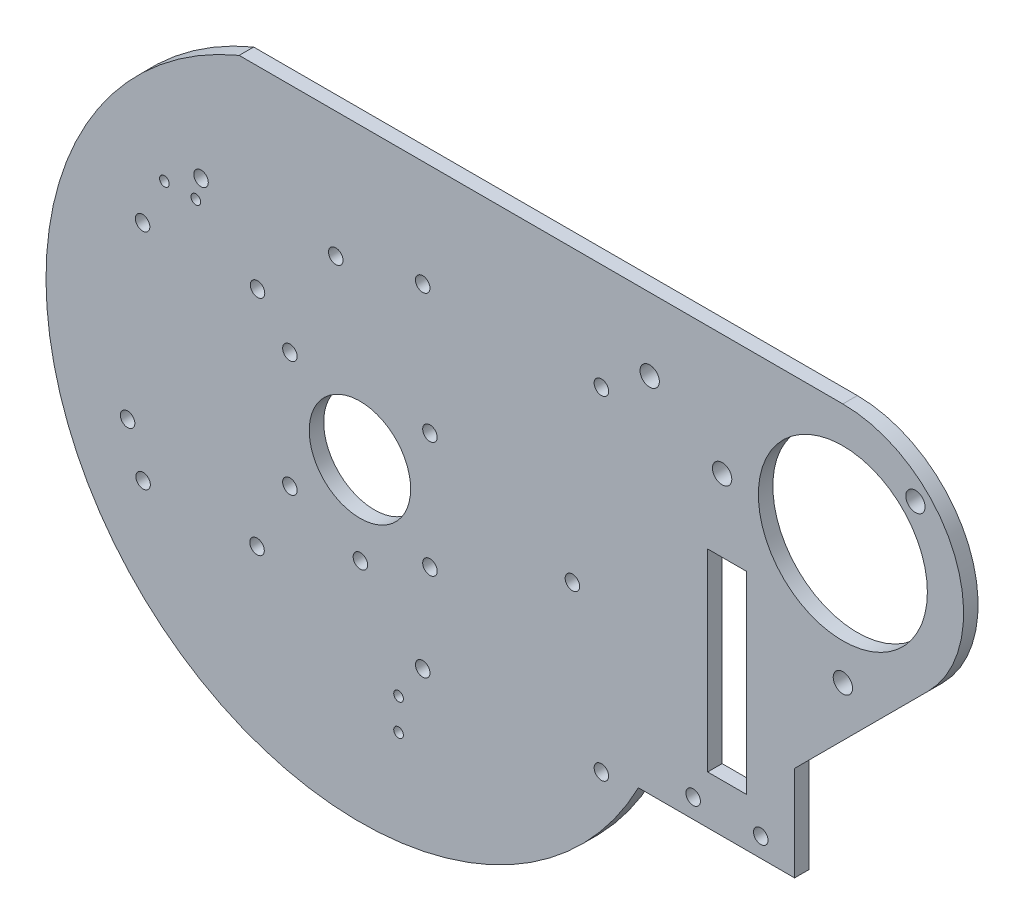
from build123d import *

# Parameters (mm, degrees)
SKETCH1_R                 = 10.5
SKETCH1_R_2               = 1.5
SKETCH1_W                 = 8
SKETCH1_H                 = 40
SKETCH1_R_3               = 17.5
BOSS_EXTRUDE1_DEPTH       = 3
CUT_EXTRUDE1_REACH        = 140.687
SKETCH2_R                 = 2
CUT_EXTRUDE2_REACH        = 140.687
SKETCH3_R                 = 2
BOSS_EXTRUDE2_START       = -3
SKETCH4_R                 = 65
SKETCH4_R_2               = 60
BOSS_EXTRUDE2_DEPTH       = 3
CUT_EXTRUDE3_START        = -10
CUT_EXTRUDE3_DEPTH        = 10
CUT_EXTRUDE4_START        = -10
CUT_EXTRUDE4_DEPTH        = 10
CUT_EXTRUDE5_REACH        = 142.922
SKETCH7_R                 = 1.5
CUT_EXTRUDE6_REACH        = 142.922
SKETCH8_R                 = 1.5
CUT_EXTRUDE7_REACH        = 142.922
SKETCH9_R                 = 1.5
F_3_0MM_DOWEL_HOLE1_D     = 3
F_3_0MM_DOWEL_HOLE1_DEPTH = 11.3
F_3_0MM_DOWEL_HOLE1_TIP   = 0.901290929
CUT_EXTRUDE8_REACH        = 142.922
SKETCH13_R                = 1


with BuildPart() as part:
    # Sketch1 → Boss-Extrude1 (new body)
    # profile 1 of 2: a face of its own
    with BuildSketch(Plane.XY):
        with BuildLine():
            ThreePointArc((-60, 0), (-52.867640737, 28.372743309), (-33.166247904, 50))
            Line((-33.166247904, 50), (-60, 50))
            Line((-60, 50), (-60, 0))
        make_face()
    # profile 2 of 2: a face of its own
    with BuildSketch(Plane.XY):
        with BuildLine():
            ThreePointArc((0, 60), (-17.320508076, 57.445626465), (-33.166247904, 50))
            ThreePointArc((-33.166247904, 50), (-52.867640737, 28.372743309), (-60, 0))
            ThreePointArc((-60, 0), (-15.529142706, -57.955549577), (51.961524227, -30))
            Line((51.961524227, -30), (56.568542495, -30))
            Line((56.568542495, -30), (90, -30))
            Line((90, -30), (90, -10.355339059))
            Line((90, -10.355339059), (117.67766953, 17.32233047))
            ThreePointArc((117.67766953, 17.32233047), (123.096988313, 44.567085809), (100, 60))
            Line((100, 60), (0, 60))
        make_face()
        Circle(SKETCH1_R, mode=Mode.SUBTRACT)
        with Locations((69, -26)):
            Circle(SKETCH1_R_2, mode=Mode.SUBTRACT)
        with Locations((76, 0)):
            Rectangle(SKETCH1_W, SKETCH1_H, mode=Mode.SUBTRACT)
        with Locations((83, -26)):
            Circle(SKETCH1_R_2, mode=Mode.SUBTRACT)
        with Locations((100, 35)):
            Circle(SKETCH1_R_3, mode=Mode.SUBTRACT)
    extrude(amount=BOSS_EXTRUDE1_DEPTH)

    # Sketch2 → Cut-Extrude1 (cut, up to next)
    with BuildSketch(Plane.XY.offset(3), mode=Mode.PRIVATE) as cut_extrude1_sk1:
        with Locations((60, 45)):
            Circle(SKETCH2_R)
    cut_extrude1_tool1 = extrude(cut_extrude1_sk1.sketch, amount=-CUT_EXTRUDE1_REACH, mode=Mode.PRIVATE) & part.part
    add(cut_extrude1_tool1.solids().sort_by_distance((60, 45, 3))[0], mode=Mode.SUBTRACT)

    # Sketch3 → Cut-Extrude2 (cut, up to next)
    with BuildSketch(Plane.XY.offset(3), mode=Mode.PRIVATE) as cut_extrude2_sk1:
        with Locations((100, 10)):
            Circle(SKETCH3_R)
    cut_extrude2_tool1 = extrude(cut_extrude2_sk1.sketch, amount=-CUT_EXTRUDE2_REACH, mode=Mode.PRIVATE) & part.part
    # Sketch3 → Cut-Extrude2 (cut, up to next)
    with BuildSketch(Plane.XY.offset(3), mode=Mode.PRIVATE) as cut_extrude2_sk2:
        with Locations((75, 35)):
            Circle(SKETCH3_R)
    cut_extrude2_tool2 = extrude(cut_extrude2_sk2.sketch, amount=-CUT_EXTRUDE2_REACH, mode=Mode.PRIVATE) & part.part
    # Sketch3 → Cut-Extrude2 (cut, up to next)
    with BuildSketch(Plane.XY.offset(3), mode=Mode.PRIVATE) as cut_extrude2_sk3:
        with Locations((115.0260191, 50.0260191)):
            Circle(SKETCH3_R)
    cut_extrude2_tool3 = extrude(cut_extrude2_sk3.sketch, amount=-CUT_EXTRUDE2_REACH, mode=Mode.PRIVATE) & part.part
    add(cut_extrude2_tool1.solids().sort_by_distance((100, 10, 3))[0], mode=Mode.SUBTRACT)
    add(cut_extrude2_tool2.solids().sort_by_distance((75, 35, 3))[0], mode=Mode.SUBTRACT)
    add(cut_extrude2_tool3.solids().sort_by_distance((115.026019, 50.026019, 3))[0], mode=Mode.SUBTRACT)

    # Sketch4 → Boss-Extrude2 (add)
    with BuildSketch(Plane.XY.offset(3).offset(BOSS_EXTRUDE2_START)):
        Circle(SKETCH4_R)
        Circle(SKETCH4_R_2, mode=Mode.SUBTRACT)
    extrude(amount=BOSS_EXTRUDE2_DEPTH)

    # Sketch5 → Cut-Extrude3 (cut)
    with BuildSketch(Plane.XY.offset(3).offset(CUT_EXTRUDE3_START)):
        with BuildLine():
            Line((-60, 50), (-41.533119315, 50))
            ThreePointArc((-41.533119315, 50), (-52.282822987, 38.62002616), (-60, 25))
            Line((-60, 25), (-60, 50))
        make_face()
    extrude(amount=CUT_EXTRUDE3_DEPTH, mode=Mode.SUBTRACT)

    # Sketch6 → Cut-Extrude4 (cut)
    with BuildSketch(Plane.XY.offset(3).offset(CUT_EXTRUDE4_START)):
        with BuildLine():
            Line((25, 60), (-25, 60))
            ThreePointArc((-25, 60), (0, 65), (25, 60))
        make_face()
    extrude(amount=CUT_EXTRUDE4_DEPTH, mode=Mode.SUBTRACT)

    # Sketch7 → Cut-Extrude5 (cut, up to next)
    with BuildSketch(Plane.XY.offset(3), mode=Mode.PRIVATE) as cut_extrude5_sk1:
        with Locations((-14.5, 12)):
            Circle(SKETCH7_R)
    cut_extrude5_tool1 = extrude(cut_extrude5_sk1.sketch, amount=-CUT_EXTRUDE5_REACH, mode=Mode.PRIVATE) & part.part
    # Sketch7 → Cut-Extrude5 (cut, up to next)
    with BuildSketch(Plane.XY.offset(3), mode=Mode.PRIVATE) as cut_extrude5_sk2:
        with Locations((14.5, 12)):
            Circle(SKETCH7_R)
    cut_extrude5_tool2 = extrude(cut_extrude5_sk2.sketch, amount=-CUT_EXTRUDE5_REACH, mode=Mode.PRIVATE) & part.part
    # Sketch7 → Cut-Extrude5 (cut, up to next)
    with BuildSketch(Plane.XY.offset(3), mode=Mode.PRIVATE) as cut_extrude5_sk3:
        with Locations((-14.5, -12)):
            Circle(SKETCH7_R)
    cut_extrude5_tool3 = extrude(cut_extrude5_sk3.sketch, amount=-CUT_EXTRUDE5_REACH, mode=Mode.PRIVATE) & part.part
    # Sketch7 → Cut-Extrude5 (cut, up to next)
    with BuildSketch(Plane.XY.offset(3), mode=Mode.PRIVATE) as cut_extrude5_sk4:
        with Locations((14.5, -12)):
            Circle(SKETCH7_R)
    cut_extrude5_tool4 = extrude(cut_extrude5_sk4.sketch, amount=-CUT_EXTRUDE5_REACH, mode=Mode.PRIVATE) & part.part
    add(cut_extrude5_tool1.solids().sort_by_distance((-14.5, 12, 3))[0], mode=Mode.SUBTRACT)
    add(cut_extrude5_tool2.solids().sort_by_distance((14.5, 12, 3))[0], mode=Mode.SUBTRACT)
    add(cut_extrude5_tool3.solids().sort_by_distance((-14.5, -12, 3))[0], mode=Mode.SUBTRACT)
    add(cut_extrude5_tool4.solids().sort_by_distance((14.5, -12, 3))[0], mode=Mode.SUBTRACT)

    # Sketch8 → Cut-Extrude6 (cut, up to next)
    with BuildSketch(Plane.XY.offset(3), mode=Mode.PRIVATE) as cut_extrude6_sk1:
        with Locations((50, 38)):
            Circle(SKETCH8_R)
    cut_extrude6_tool1 = extrude(cut_extrude6_sk1.sketch, amount=-CUT_EXTRUDE6_REACH, mode=Mode.PRIVATE) & part.part
    # Sketch8 → Cut-Extrude6 (cut, up to next)
    with BuildSketch(Plane.XY.offset(3), mode=Mode.PRIVATE) as cut_extrude6_sk2:
        with Locations((13, 38)):
            Circle(SKETCH8_R)
    cut_extrude6_tool2 = extrude(cut_extrude6_sk2.sketch, amount=-CUT_EXTRUDE6_REACH, mode=Mode.PRIVATE) & part.part
    # Sketch8 → Cut-Extrude6 (cut, up to next)
    with BuildSketch(Plane.XY.offset(3), mode=Mode.PRIVATE) as cut_extrude6_sk3:
        with Locations((50, -31)):
            Circle(SKETCH8_R)
    cut_extrude6_tool3 = extrude(cut_extrude6_sk3.sketch, amount=-CUT_EXTRUDE6_REACH, mode=Mode.PRIVATE) & part.part
    # Sketch8 → Cut-Extrude6 (cut, up to next)
    with BuildSketch(Plane.XY.offset(3), mode=Mode.PRIVATE) as cut_extrude6_sk4:
        with Locations((13, -31)):
            Circle(SKETCH8_R)
    cut_extrude6_tool4 = extrude(cut_extrude6_sk4.sketch, amount=-CUT_EXTRUDE6_REACH, mode=Mode.PRIVATE) & part.part
    # Sketch8 → Cut-Extrude6 (cut, up to next)
    with BuildSketch(Plane.XY.offset(3), mode=Mode.PRIVATE) as cut_extrude6_sk5:
        with Locations((-5, 34)):
            Circle(SKETCH8_R)
    cut_extrude6_tool5 = extrude(cut_extrude6_sk5.sketch, amount=-CUT_EXTRUDE6_REACH, mode=Mode.PRIVATE) & part.part
    # Sketch8 → Cut-Extrude6 (cut, up to next)
    with BuildSketch(Plane.XY.offset(3), mode=Mode.PRIVATE) as cut_extrude6_sk6:
        with Locations((-32.9, 34)):
            Circle(SKETCH8_R)
    cut_extrude6_tool6 = extrude(cut_extrude6_sk6.sketch, amount=-CUT_EXTRUDE6_REACH, mode=Mode.PRIVATE) & part.part
    # Sketch8 → Cut-Extrude6 (cut, up to next)
    with BuildSketch(Plane.XY.offset(3), mode=Mode.PRIVATE) as cut_extrude6_sk7:
        with Locations((0.1, -18.1)):
            Circle(SKETCH8_R)
    cut_extrude6_tool7 = extrude(cut_extrude6_sk7.sketch, amount=-CUT_EXTRUDE6_REACH, mode=Mode.PRIVATE) & part.part
    # Sketch8 → Cut-Extrude6 (cut, up to next)
    with BuildSketch(Plane.XY.offset(3), mode=Mode.PRIVATE) as cut_extrude6_sk8:
        with Locations((-48.1, -16.8)):
            Circle(SKETCH8_R)
    cut_extrude6_tool8 = extrude(cut_extrude6_sk8.sketch, amount=-CUT_EXTRUDE6_REACH, mode=Mode.PRIVATE) & part.part
    add(cut_extrude6_tool1.solids().sort_by_distance((50, 38, 3))[0], mode=Mode.SUBTRACT)
    add(cut_extrude6_tool2.solids().sort_by_distance((13, 38, 3))[0], mode=Mode.SUBTRACT)
    add(cut_extrude6_tool3.solids().sort_by_distance((50, -31, 3))[0], mode=Mode.SUBTRACT)
    add(cut_extrude6_tool4.solids().sort_by_distance((13, -31, 3))[0], mode=Mode.SUBTRACT)
    add(cut_extrude6_tool5.solids().sort_by_distance((-5, 34, 3))[0], mode=Mode.SUBTRACT)
    add(cut_extrude6_tool6.solids().sort_by_distance((-32.9, 34, 3))[0], mode=Mode.SUBTRACT)
    add(cut_extrude6_tool7.solids().sort_by_distance((0.1, -18.1, 3))[0], mode=Mode.SUBTRACT)
    add(cut_extrude6_tool8.solids().sort_by_distance((-48.1, -16.8, 3))[0], mode=Mode.SUBTRACT)

    # Sketch9 → Cut-Extrude7 (cut, up to next)
    with BuildSketch(Plane.XY.offset(3), mode=Mode.PRIVATE) as cut_extrude7_sk1:
        with Locations((-21.3, -26.2)):
            Circle(SKETCH9_R)
    cut_extrude7_tool1 = extrude(cut_extrude7_sk1.sketch, amount=-CUT_EXTRUDE7_REACH, mode=Mode.PRIVATE) & part.part
    # Sketch9 → Cut-Extrude7 (cut, up to next)
    with BuildSketch(Plane.XY.offset(3), mode=Mode.PRIVATE) as cut_extrude7_sk2:
        with Locations((-21.2, 20)):
            Circle(SKETCH9_R)
    cut_extrude7_tool2 = extrude(cut_extrude7_sk2.sketch, amount=-CUT_EXTRUDE7_REACH, mode=Mode.PRIVATE) & part.part
    # Sketch9 → Cut-Extrude7 (cut, up to next)
    with BuildSketch(Plane.XY.offset(3), mode=Mode.PRIVATE) as cut_extrude7_sk3:
        with Locations((-45, 20)):
            Circle(SKETCH9_R)
    cut_extrude7_tool3 = extrude(cut_extrude7_sk3.sketch, amount=-CUT_EXTRUDE7_REACH, mode=Mode.PRIVATE) & part.part
    # Sketch9 → Cut-Extrude7 (cut, up to next)
    with BuildSketch(Plane.XY.offset(3), mode=Mode.PRIVATE) as cut_extrude7_sk4:
        with Locations((-44.9, -26.2)):
            Circle(SKETCH9_R)
    cut_extrude7_tool4 = extrude(cut_extrude7_sk4.sketch, amount=-CUT_EXTRUDE7_REACH, mode=Mode.PRIVATE) & part.part
    add(cut_extrude7_tool1.solids().sort_by_distance((-21.3, -26.2, 3))[0], mode=Mode.SUBTRACT)
    add(cut_extrude7_tool2.solids().sort_by_distance((-21.2, 20, 3))[0], mode=Mode.SUBTRACT)
    add(cut_extrude7_tool3.solids().sort_by_distance((-45, 20, 3))[0], mode=Mode.SUBTRACT)
    add(cut_extrude7_tool4.solids().sort_by_distance((-44.9, -26.2, 3))[0], mode=Mode.SUBTRACT)

    # Ø3.0mm Dowel Hole1
    with Locations(Plane.XY.offset(3)):
        with Locations((44, 0)):
            Hole(F_3_0MM_DOWEL_HOLE1_D / 2, depth=F_3_0MM_DOWEL_HOLE1_DEPTH)
            with Locations((0, 0, -(F_3_0MM_DOWEL_HOLE1_DEPTH + F_3_0MM_DOWEL_HOLE1_TIP / 2))):  # 118° drill point
                Cone(0, F_3_0MM_DOWEL_HOLE1_D / 2, F_3_0MM_DOWEL_HOLE1_TIP, mode=Mode.SUBTRACT)

    # Sketch13 → Cut-Extrude8 (cut, up to next)
    with BuildSketch(Plane.XY.offset(3), mode=Mode.PRIVATE) as cut_extrude8_sk1:
        with Locations((-40.478838325, 29.696152423)):
            Circle(SKETCH13_R)
    cut_extrude8_tool1 = extrude(cut_extrude8_sk1.sketch, amount=-CUT_EXTRUDE8_REACH, mode=Mode.PRIVATE) & part.part
    # Sketch13 → Cut-Extrude8 (cut, up to next)
    with BuildSketch(Plane.XY.offset(3), mode=Mode.PRIVATE) as cut_extrude8_sk2:
        with Locations((-33.978838325, 29.696152423)):
            Circle(SKETCH13_R)
    cut_extrude8_tool2 = extrude(cut_extrude8_sk2.sketch, amount=-CUT_EXTRUDE8_REACH, mode=Mode.PRIVATE) & part.part
    # Sketch13 → Cut-Extrude8 (cut, up to next)
    with BuildSketch(Plane.XY.offset(3), mode=Mode.PRIVATE) as cut_extrude8_sk3:
        with Locations((8, -38.4)):
            Circle(SKETCH13_R)
    cut_extrude8_tool3 = extrude(cut_extrude8_sk3.sketch, amount=-CUT_EXTRUDE8_REACH, mode=Mode.PRIVATE) & part.part
    # Sketch13 → Cut-Extrude8 (cut, up to next)
    with BuildSketch(Plane.XY.offset(3), mode=Mode.PRIVATE) as cut_extrude8_sk4:
        with Locations((8, -44.9)):
            Circle(SKETCH13_R)
    cut_extrude8_tool4 = extrude(cut_extrude8_sk4.sketch, amount=-CUT_EXTRUDE8_REACH, mode=Mode.PRIVATE) & part.part
    add(cut_extrude8_tool1.solids().sort_by_distance((-40.478838, 29.696152, 3))[0], mode=Mode.SUBTRACT)
    add(cut_extrude8_tool2.solids().sort_by_distance((-33.978838, 29.696152, 3))[0], mode=Mode.SUBTRACT)
    add(cut_extrude8_tool3.solids().sort_by_distance((8, -38.4, 3))[0], mode=Mode.SUBTRACT)
    add(cut_extrude8_tool4.solids().sort_by_distance((8, -44.9, 3))[0], mode=Mode.SUBTRACT)


solid = part.part
